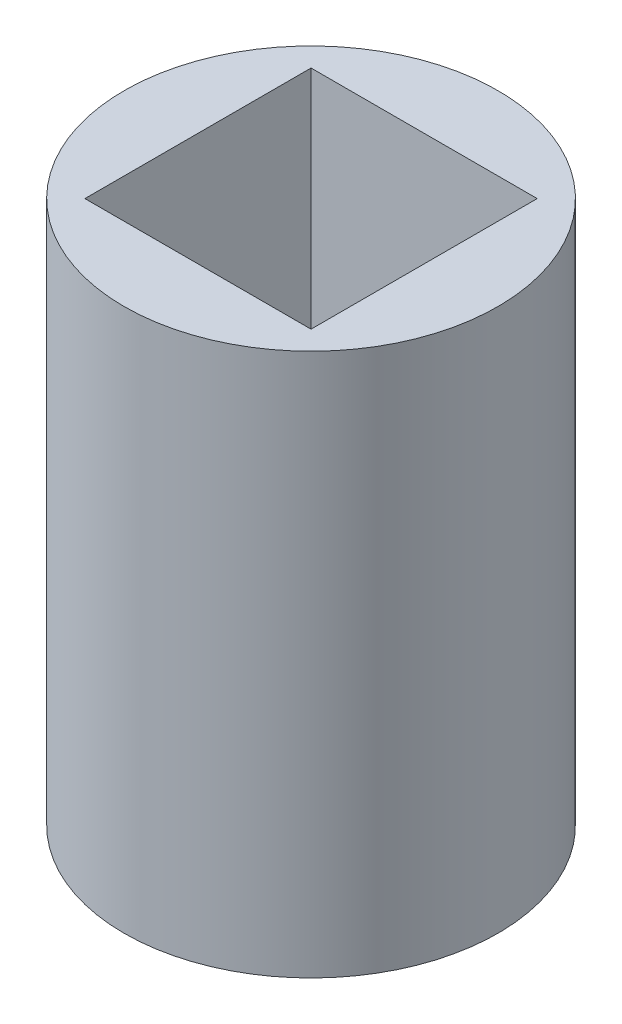
from build123d import *

# Parameters (mm, degrees)
SKETCH1_R           = 7.874
SKETCH1_W           = 9.525
SKETCH1_H           = 9.525
BOSS_EXTRUDE1_DEPTH = 22.86


with BuildPart() as part:
    # Sketch1 → Boss-Extrude1 (new body)
    with BuildSketch(Plane(origin=(0, 0, 0), x_dir=(1, 0, 0), z_dir=(0, 1, 0))):
        with Locations(Location((0, 0, 0), (0, 0, 270))):
            Circle(SKETCH1_R)
        Rectangle(SKETCH1_W, SKETCH1_H, mode=Mode.SUBTRACT)
    extrude(amount=BOSS_EXTRUDE1_DEPTH)


solid = part.part
